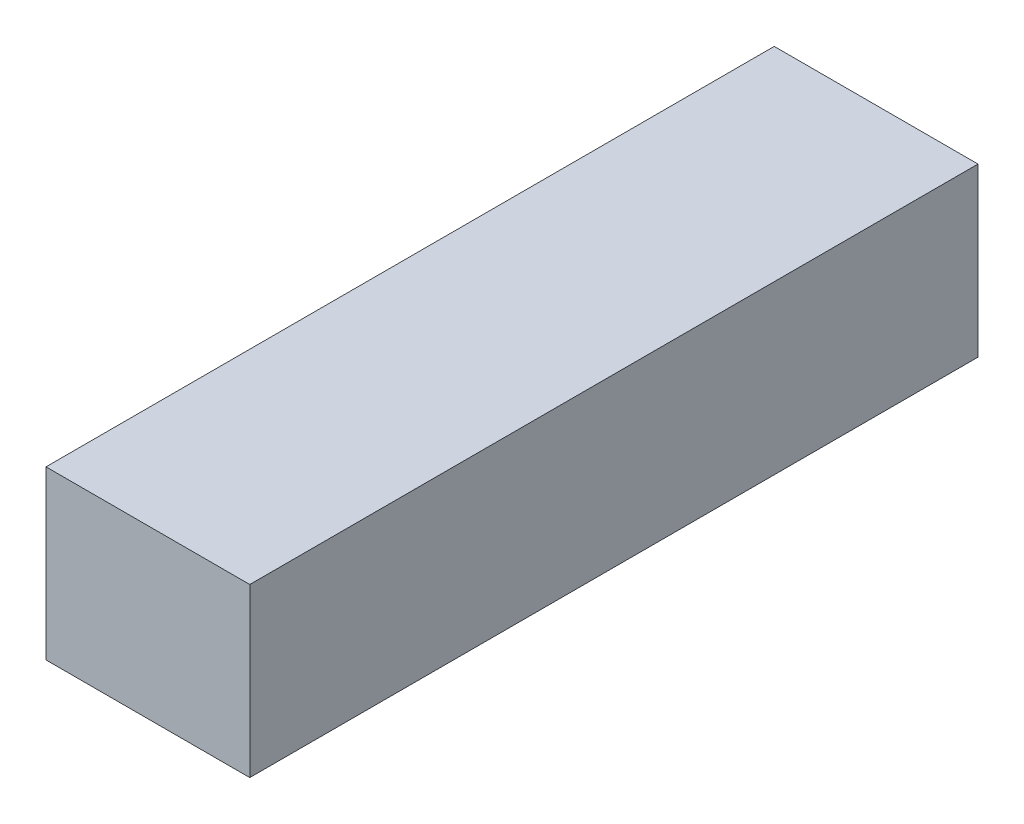
from build123d import *

# Parameters (mm, degrees)
SKETCH_1_W      = 139.904810354
SKETCH_1_H      = 114.829166666
EXTRUDE_1_DEPTH = 500


with BuildPart() as part:
    # 草图1 → 凸台-拉伸1 (new body)
    with BuildSketch(Plane.XY):
        Rectangle(SKETCH_1_W, SKETCH_1_H)
    extrude(amount=EXTRUDE_1_DEPTH)


solid = part.part
